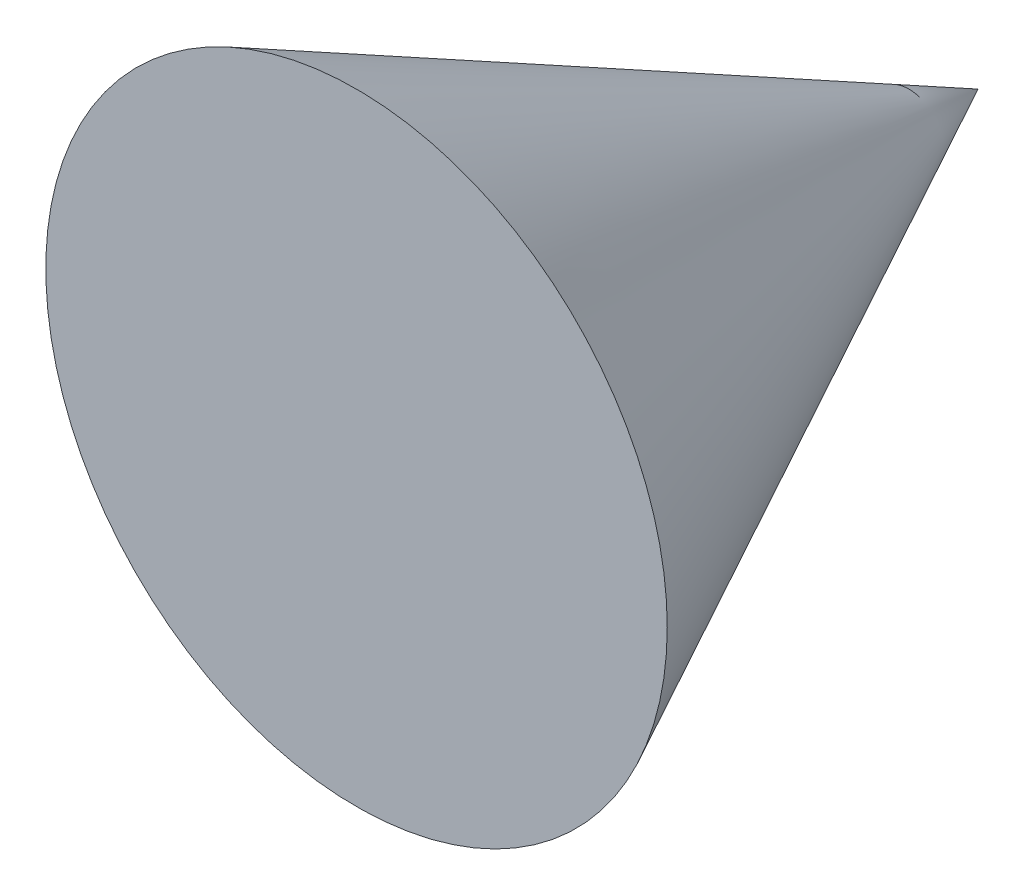
from build123d import *


with BuildPart() as part:
    # 草图1 → 旋转1 (revolve)
    with BuildSketch(Plane(origin=(0, 0, 0), x_dir=(1, 0, 0), z_dir=(0, 1, 0))):
        Polygon((0, 0), (100, 0), (0, 200), align=None)
    revolve(axis=Axis((0, 0, 0), (0, 0, -1)))


solid = part.part
